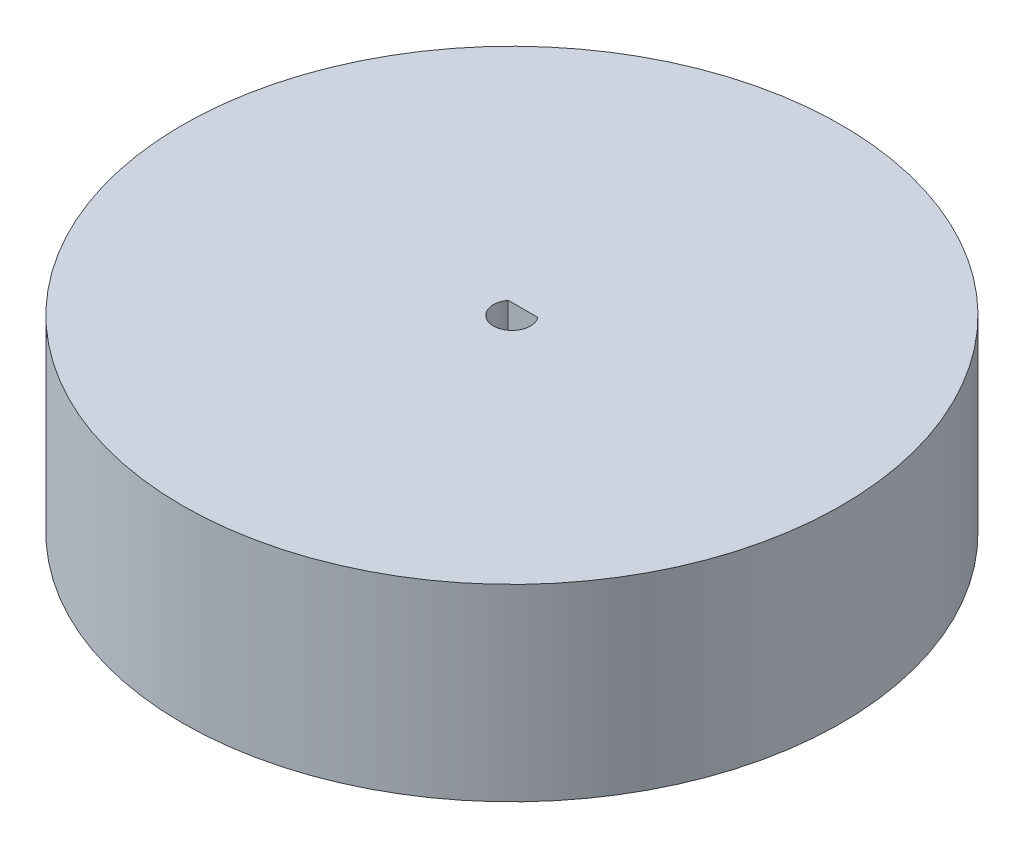
from build123d import *

# Parameters (mm, degrees)
SKETCH1_R           = 22.225
BOSS_EXTRUDE1_DEPTH = 12.7


with BuildPart() as part:
    # Sketch1 → Boss-Extrude1 (new body)
    # profile 1 of 2: a face of its own
    with BuildSketch(Plane(origin=(0, 0, 0), x_dir=(1, 0, 0), z_dir=(0, 1, 0))):
        with Locations(Location((0, 0, 0), (0, 0, 270))):
            Circle(SKETCH1_R)
        with BuildLine():
            ThreePointArc((1.25, 0), (-0.395284708, -1.185854123), (-1, 0.75))
            ThreePointArc((-1, 0.75), (0, 1.25), (1, 0.75))
            ThreePointArc((1, 0.75), (1.185854123, 0.395284708), (1.25, 0))
        make_face(mode=Mode.SUBTRACT)
    # profile 2 of 2: a face of its own
    with BuildSketch(Plane(origin=(0, 0, 0), x_dir=(1, 0, 0), z_dir=(0, 1, 0))):
        with BuildLine():
            ThreePointArc((1, 0.75), (0, 1.25), (-1, 0.75))
            Line((-1, 0.75), (1, 0.75))
        make_face()
    extrude(amount=BOSS_EXTRUDE1_DEPTH)


solid = part.part
